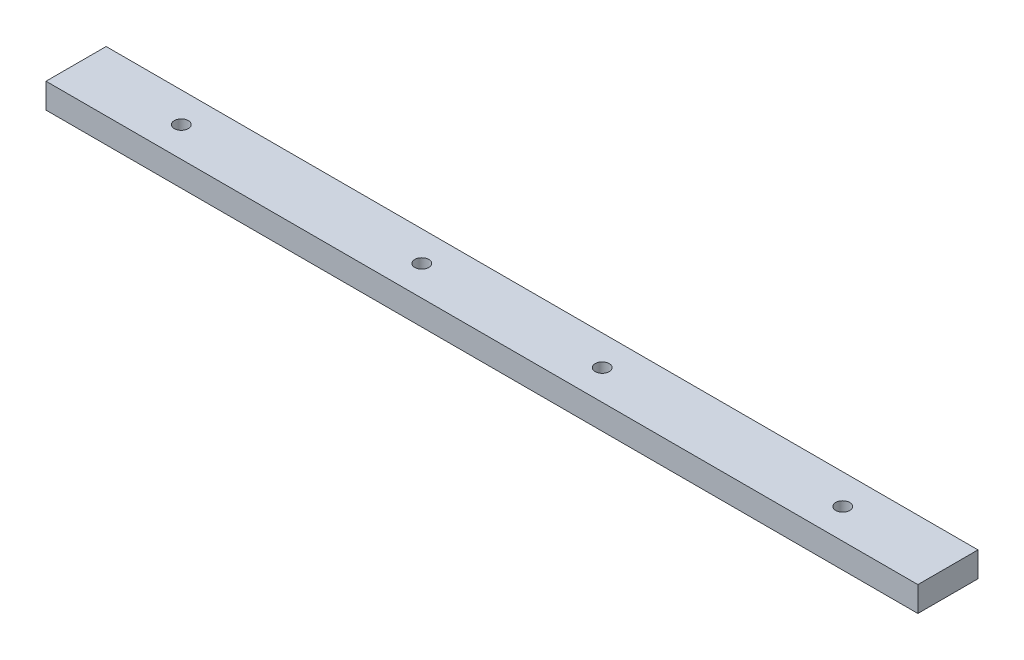
from build123d import *

# Parameters (mm, degrees)
SKETCH1_W                    = 174
SKETCH1_H                    = 12
SKETCH1_R                    = 1.4
BOTTOM_SCREWHOLE_BLOCK_DEPTH = 5


with BuildPart() as part:
    # Sketch1 → Bottom screwhole block (new body)
    with BuildSketch(Plane(origin=(0, 0, 0), x_dir=(1, 0, 0), z_dir=(0, 1, 0))):
        Rectangle(SKETCH1_W, SKETCH1_H)
        with Locations(Location((-66, 0, 0), (0, 0, 270))):
            Circle(SKETCH1_R, mode=Mode.SUBTRACT)
        with Locations(Location((-18, 0, 0), (0, 0, 270))):
            Circle(SKETCH1_R, mode=Mode.SUBTRACT)
        with Locations(Location((18, 0, 0), (0, 0, 270))):
            Circle(SKETCH1_R, mode=Mode.SUBTRACT)
        with Locations(Location((66, 0, 0), (0, 0, 270))):
            Circle(SKETCH1_R, mode=Mode.SUBTRACT)
    extrude(amount=BOTTOM_SCREWHOLE_BLOCK_DEPTH)


solid = part.part
